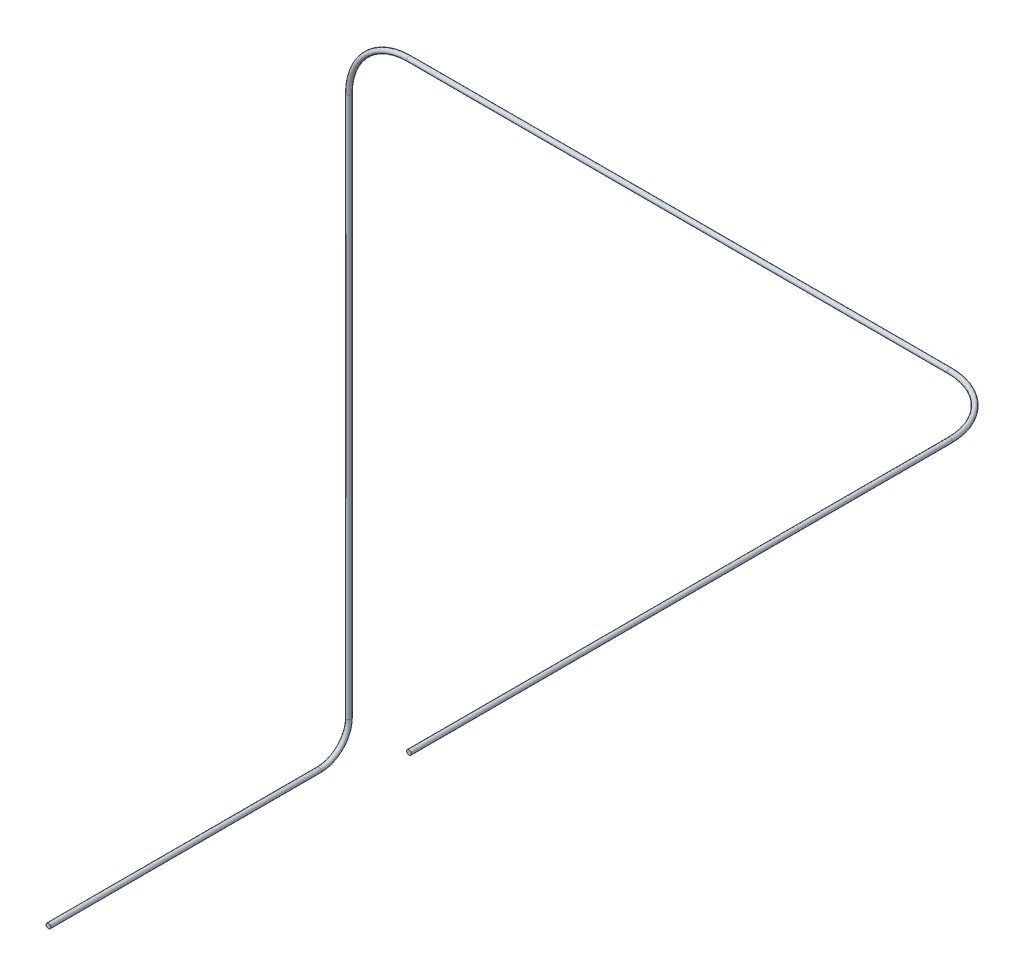
from build123d import *

# Parameters (mm, degrees)
SKETCH1_R = 2


with BuildPart() as part:
    # Sweep1: sweep along a curve in space
    with BuildLine() as sweep1_path:
        Line((0, 0, 0), (0, 0, -450))
        ThreePointArc((0, 0, -450), (-14.644660941, 0, -485.355339059), (-50, 0, -500))
        Line((-50, 0, -500), (-500, 0, -500))
        ThreePointArc((-500, 0, -500), (-535.355339059, -14.644660941, -500), (-550, -50, -500))
        Line((-550, -50, -500), (-550, -500, -500))
        ThreePointArc((-550, -525, -475), (-550, -517.67766953, -492.67766953), (-550, -500, -500))
        Line((-550, -525, -475), (-550, -525, -250))
    # Sketch1 → Sweep1 (sweep)
    with BuildSketch(Plane.XY):
        Circle(SKETCH1_R)
    sweep(path=sweep1_path.line)


solid = part.part
